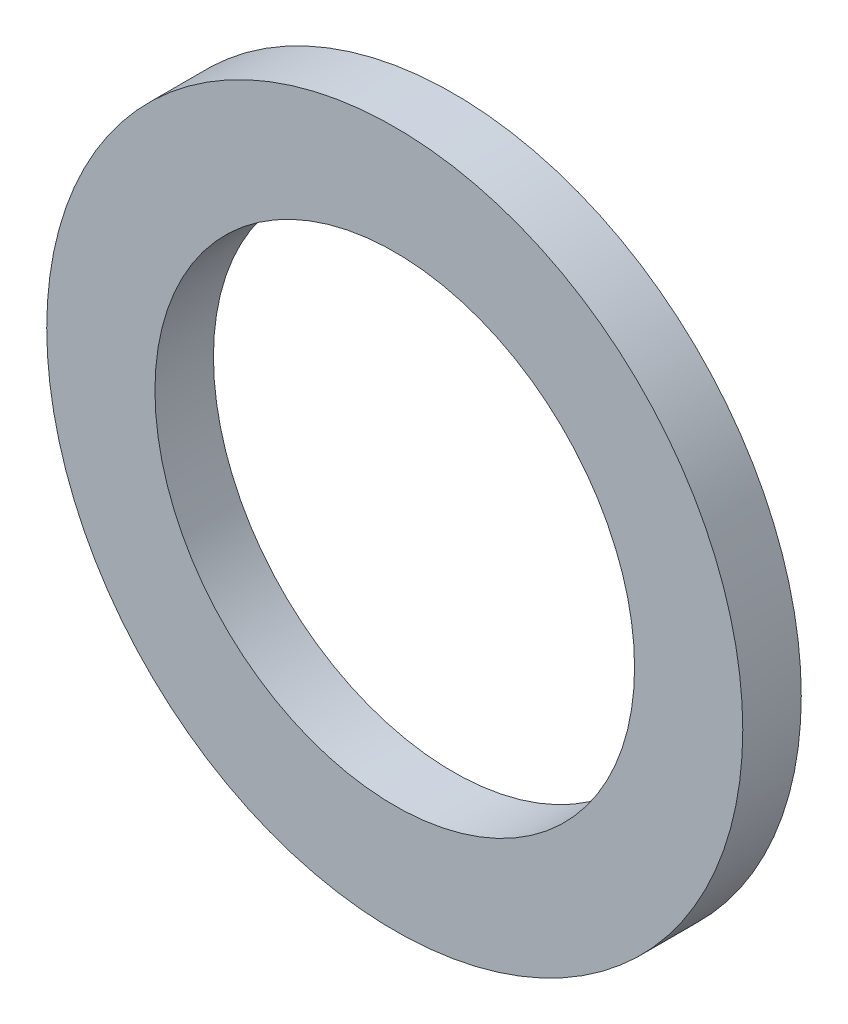
from build123d import *

# Parameters (mm, degrees)
SKETCH3_R           = 5.95
SKETCH3_R_2         = 4.1
BOSS_EXTRUDE1_DEPTH = 0.5


with BuildPart() as part:
    # Sketch3 → Boss-Extrude1 (new, symmetric)
    with BuildSketch(Plane.XY):
        Circle(SKETCH3_R)
        Circle(SKETCH3_R_2, mode=Mode.SUBTRACT)
    extrude(amount=BOSS_EXTRUDE1_DEPTH, both=True)


solid = part.part
